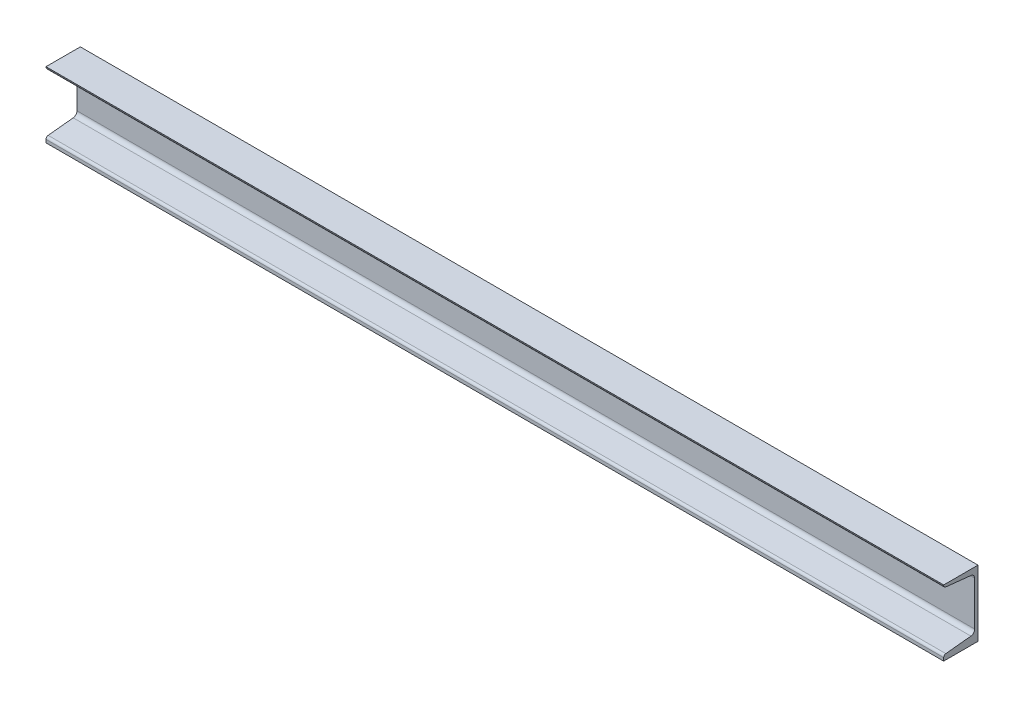
from build123d import *

# Parameters (mm, degrees)
C_CHANNEL_120_X_12_1_DEPTH = 1700


with BuildPart() as part:
    # Sketch12 → C channel 120 X 12(1) (new body)
    with BuildSketch(Plane.ZY):
        with BuildLine():
            Line((65, 125), (0, 125))
            Line((0, 125), (0, 0))
            Line((0, 0), (65, 0))
            Line((65, 0), (65, 5.845330836))
            ThreePointArc((65, 5.845330836), (63.844151715, 8.856418565), (60.970378085, 10.320679365))
            Line((60.970378085, 10.320679365), (13.463772294, 15.313824837))
            ThreePointArc((13.463772294, 15.313824837), (8.354841396, 17.916955149), (6.3, 23.27))
            Line((6.3, 23.27), (6.3, 106.74))
            ThreePointArc((6.3, 106.74), (8.354841396, 112.093044851), (13.463772294, 114.696175163))
            Line((13.463772294, 114.696175163), (60.970378085, 119.689320635))
            ThreePointArc((60.970378085, 119.689320635), (63.844151715, 121.153581435), (65, 124.164669164))
            Line((65, 124.164669164), (65, 125))
        make_face()
    extrude(amount=C_CHANNEL_120_X_12_1_DEPTH)


solid = part.part
